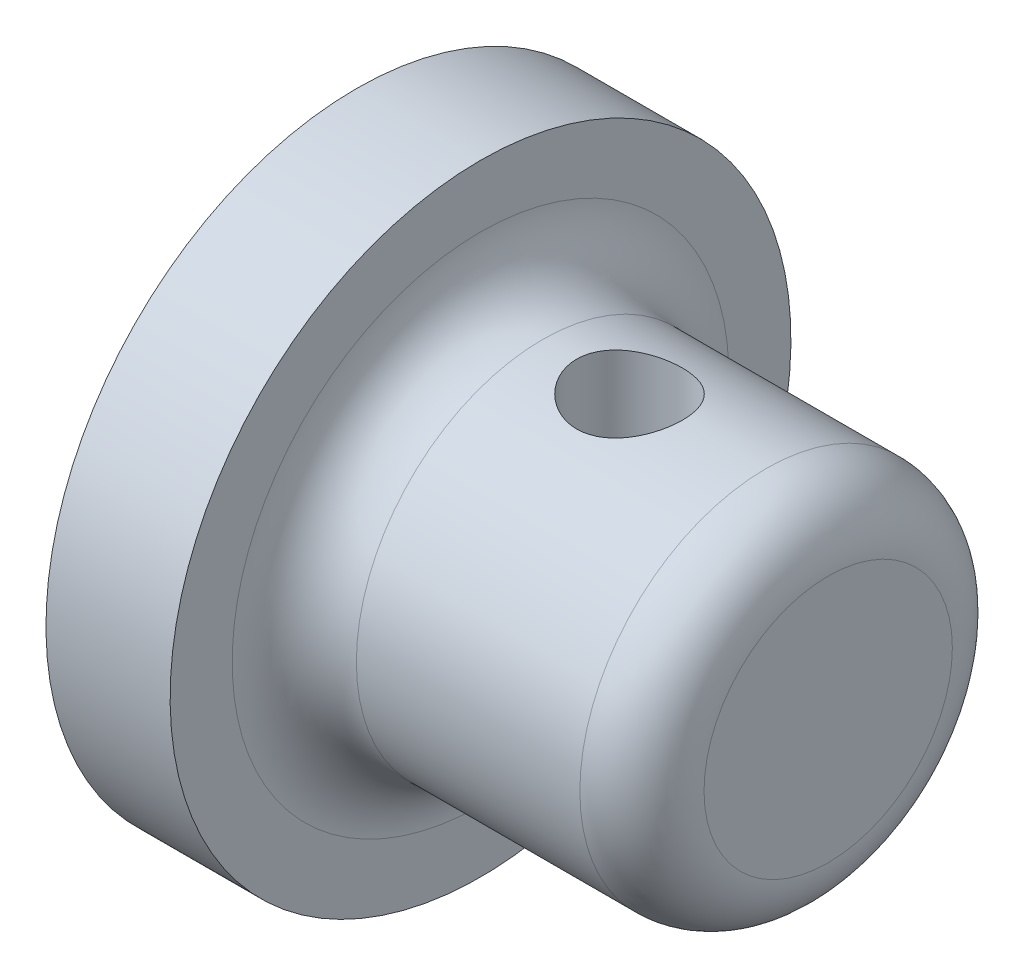
from build123d import *

# Parameters (mm, degrees)
CUT_EXTRUDE1_DEPTH          = 19.304
F_1_4_28_TAPPED_HOLE1_D     = 5.4102
F_1_4_28_TAPPED_HOLE1_DEPTH = 6.096


with BuildPart() as part:
    # Sketch1 → Revolve1 (revolve)
    with BuildSketch(Plane.XY):
        with BuildLine():
            Line((0, 0), (0, 15.875))
            Line((0, 15.875), (6.35, 15.875))
            Line((6.35, 15.875), (6.35, 12.7))
            ThreePointArc((6.35, 12.7), (7.27993597, 10.45493597), (9.525, 9.525))
            Line((9.525, 9.525), (20.955, 9.525))
            ThreePointArc((20.955, 9.525), (23.20006403, 8.59506403), (24.13, 6.35))
            Line((24.13, 6.35), (24.13, 0))
            Line((24.13, 0), (0, 0))
        make_face()
    revolve(axis=Axis((24.13, 0, 0), (-1, 0, 0)))

    # Sketch2 → Cut-Extrude1 (cut)
    with BuildSketch(Plane.ZY):
        with BuildLine():
            Line((-3.485565844, 3.429), (3.485565844, 3.429))
            ThreePointArc((3.485565844, 3.429), (0, -4.8895), (-3.485565844, 3.429))
        make_face()
    extrude(amount=-CUT_EXTRUDE1_DEPTH, mode=Mode.SUBTRACT)

    # 1/4-28 Tapped Hole1
    with Locations(Plane(origin=(0, 9.525, 0), x_dir=(1, 0, 0), z_dir=(0, 1, 0))):
        with Locations((13.97, 0)):
            Hole(F_1_4_28_TAPPED_HOLE1_D / 2, depth=F_1_4_28_TAPPED_HOLE1_DEPTH)


solid = part.part
